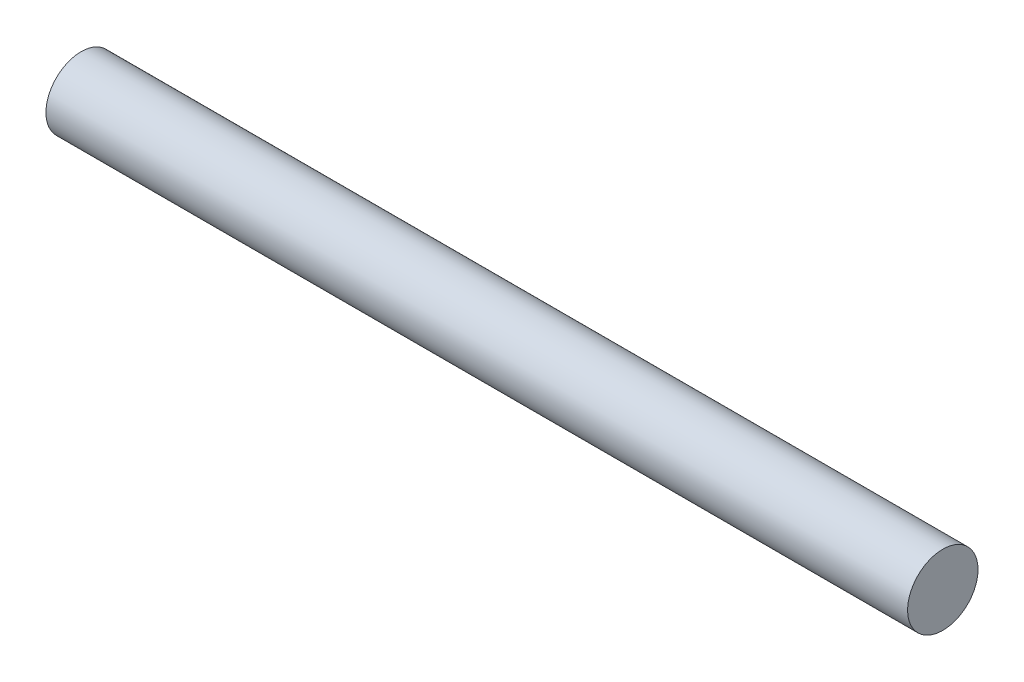
from build123d import *

# Parameters (mm, degrees)
SKETCH1_R           = 2.45
BOSS_EXTRUDE1_DEPTH = 60


with BuildPart() as part:
    # Sketch1 → Boss-Extrude1 (new body)
    with BuildSketch(Plane(origin=(0, 0, 0), x_dir=(0, 0, -1), z_dir=(1, 0, 0))):
        Circle(SKETCH1_R)
    extrude(amount=BOSS_EXTRUDE1_DEPTH)


solid = part.part
